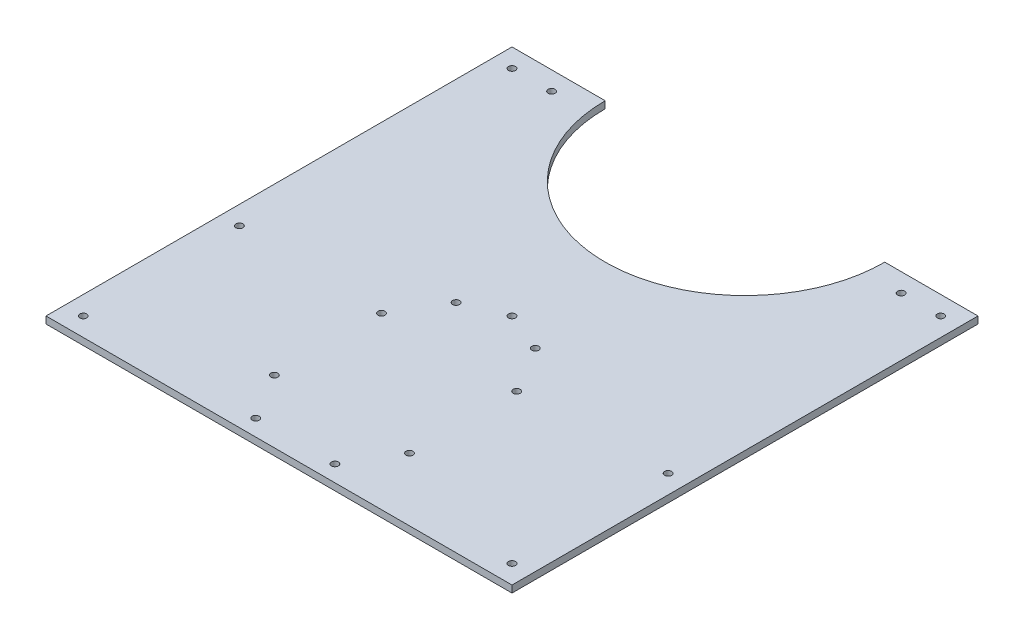
from build123d import *

# Parameters (mm, degrees)
SKETCH3_W           = 200
SKETCH3_H           = 200
BOSS_EXTRUDE1_DEPTH = 3
SKETCH4_R           = 1.5
SKETCH4_R_2         = 60
CUT_EXTRUDE1_DEPTH  = 5


with BuildPart() as part:
    # Sketch3 → Boss-Extrude1 (new body)
    with BuildSketch(Plane(origin=(0, 0, 0), x_dir=(1, 0, 0), z_dir=(0, 1, 0))):
        Rectangle(SKETCH3_W, SKETCH3_H)
    extrude(amount=BOSS_EXTRUDE1_DEPTH)

    # Sketch4 → Cut-Extrude1 (cut)
    with BuildSketch(Plane(origin=(0, 3, 0), x_dir=(1, 0, 0), z_dir=(0, 1, 0))):
        with Locations(Location((92, 92, 0), (0, 0, 270))):
            Circle(SKETCH4_R)
        with Locations(Location((92, -92, 0), (0, 0, 270))):
            Circle(SKETCH4_R)
        with Locations(Location((-92, -92, 0), (0, 0, 270))):
            Circle(SKETCH4_R)
        with Locations(Location((-92, 92, 0), (0, 0, 270))):
            Circle(SKETCH4_R)
        with Locations(Location((92, -25, 0), (0, 0, 270))):
            Circle(SKETCH4_R)
        with Locations(Location((17, -93, 0), (0, 0, 270))):
            Circle(SKETCH4_R)
        with Locations(Location((29, -73, 0), (0, 0, 270))):
            Circle(SKETCH4_R)
        with Locations(Location((75, 92, 0), (0, 0, 270))):
            Circle(SKETCH4_R)
        with Locations(Location((29, -27, 0), (0, 0, 270))):
            Circle(SKETCH4_R)
        with Locations(Location((17, -7, 0), (0, 0, 270))):
            Circle(SKETCH4_R)
        with Locations(Location((-92, -25, 0), (0, 0, 270))):
            Circle(SKETCH4_R)
        with Locations(Location((-17, -93, 0), (0, 0, 270))):
            Circle(SKETCH4_R)
        with Locations(Location((-29, -73, 0), (0, 0, 270))):
            Circle(SKETCH4_R)
        with Locations(Location((-29, -27, 0), (0, 0, 270))):
            Circle(SKETCH4_R)
        with Locations(Location((-17, -7, 0), (0, 0, 270))):
            Circle(SKETCH4_R)
        with Locations((0, 100)):
            Circle(SKETCH4_R_2)
        with Locations(Location((-75, 92, 0), (0, 0, 270))):
            Circle(SKETCH4_R)
        with Locations(Location((0, 0, 0), (0, 0, 270))):
            Circle(SKETCH4_R)
    extrude(amount=-CUT_EXTRUDE1_DEPTH, mode=Mode.SUBTRACT)


solid = part.part
